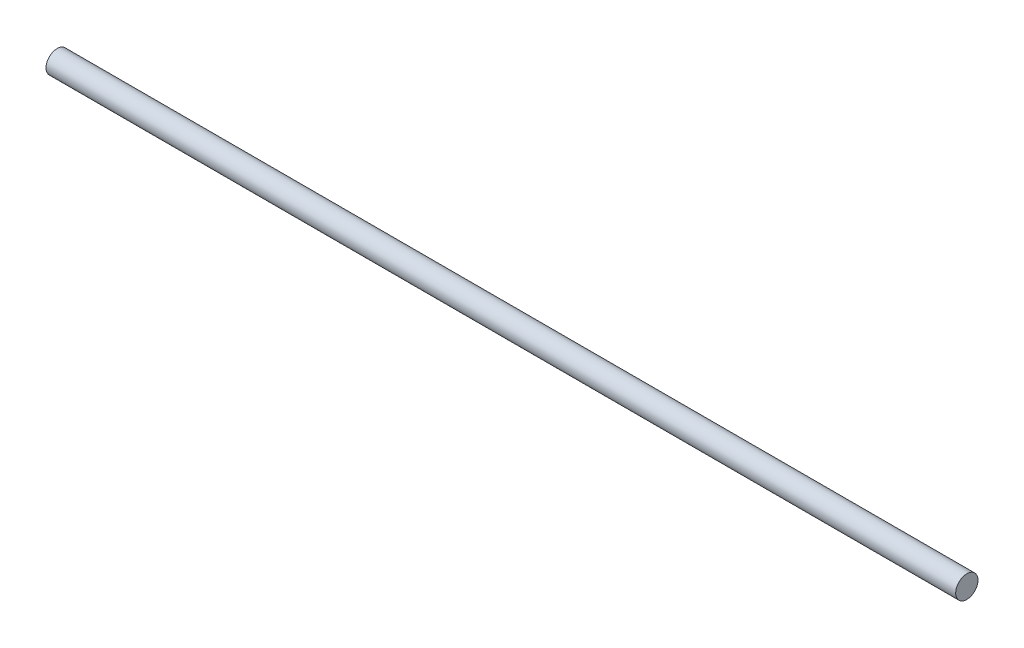
from build123d import *

# Parameters (mm, degrees)
ESQUISSE1_W = 326
ESQUISSE1_H = 4


with BuildPart() as part:
    # Esquisse1 → Révolution1 (revolve)
    with BuildSketch(Plane(origin=(0, 0, 0), x_dir=(-1, 0, 0), z_dir=(0, 0, -1)), mode=Mode.PRIVATE) as r_volution1_sk:
        with Locations((0, 2)):
            Rectangle(ESQUISSE1_W, ESQUISSE1_H)
    revolve(r_volution1_sk.sketch.rotate(Axis((163, 0, 0), (-1, 0, 0)), 180), axis=Axis((163, 0, 0), (-1, 0, 0)))


solid = part.part
